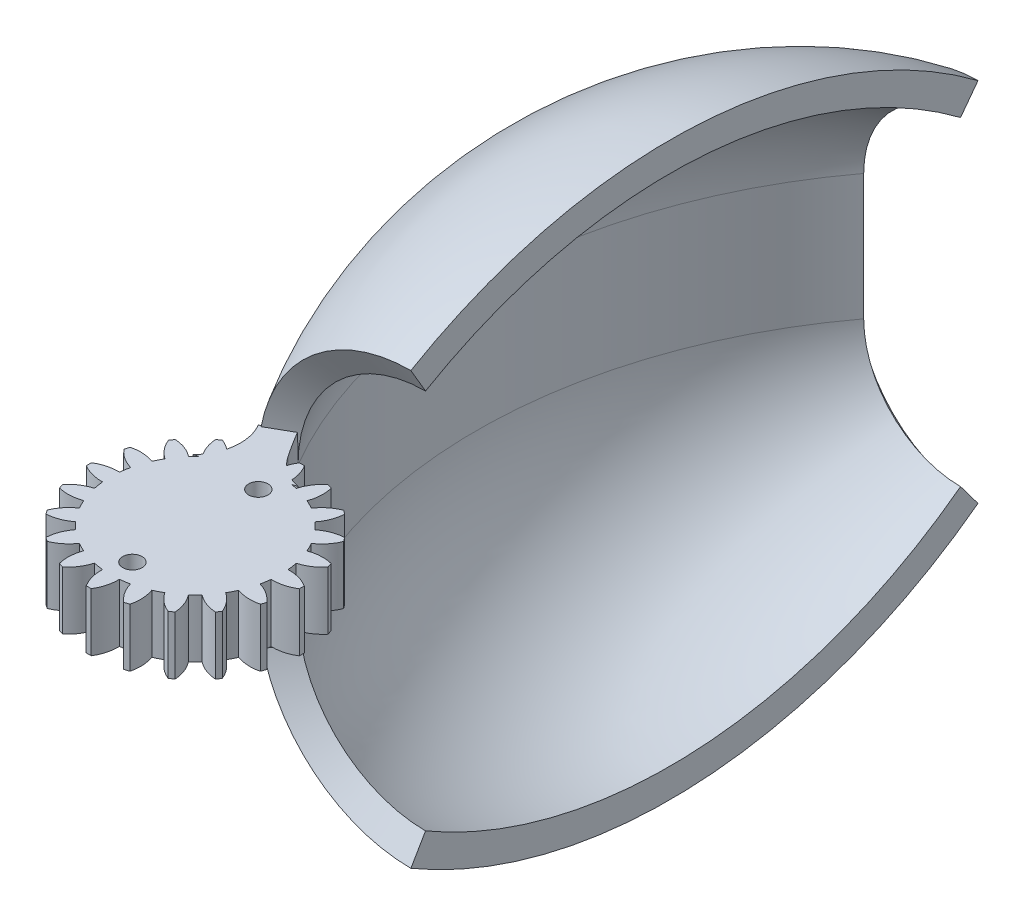
from build123d import *

# Parameters (mm, degrees)
SKETCH_1_R          = 1.25
EXTRUDE_2_DEPTH     = 3
REVOLVE_6_ANGLE     = 90
EXTRUDE_START       = 10
EXTRUDE_3_DEPTH     = 10
REVOLVE_7_ANGLE     = 90
EXTRUDE_4_DEPTH     = 10
CUT_EXTRUDE_START   = -3
CUT_EXTRUDE_1_DEPTH = 3
EXTRUDE_6_DEPTH     = 3
EXTRUDE_7_DEPTH     = 3
SKETCH_9_R          = 1
CUT_EXTRUDE_2_DEPTH = 62.302528599


with BuildPart() as part:
    # 草图1 → 凸台-拉伸2 (new body)
    with BuildSketch(Plane(origin=(0, 0, 0), x_dir=(1, 0, 0), z_dir=(0, 1, 0))):
        with BuildLine():
            Line((-2.4, 31.8), (0, 30))
            ThreePointArc((0, 30), (-9.986161593, 1.176286204), (-1.366875999, -28.085255385))
            ThreePointArc((-1.366875999, -28.085255385), (0.001505949, -29.44044019), (1.780593172, -30.177897759))
            ThreePointArc((1.780593172, -30.177897759), (2.675299798, -47.593181657), (-6.473683781, -32.747686964))
            ThreePointArc((-6.473683781, -32.747686964), (-5.105814689, -29.870106713), (-5.753780394, -26.750543539))
            ThreePointArc((-5.753780394, -26.750543539), (-12.913266641, 3.030876667), (-2.4, 31.8))
        make_face()
        with Locations(Location((0, -39, 0), (0, 0, 270))):
            Circle(SKETCH_1_R, mode=Mode.SUBTRACT)
    extrude(amount=EXTRUDE_2_DEPTH)

    # 草图2 → 旋转6 (revolve)
    with BuildSketch(Plane(origin=(0, 3, 0), x_dir=(1, 0, 0), z_dir=(0, 1, 0))):
        with BuildLine():
            Line((-5.753780394, -26.750543539), (-3.163943768, -25.236361829))
            ThreePointArc((-3.163943768, -25.236361829), (-9.918176076, 2.85931761), (0, 30))
            Line((0, 30), (-2.4, 31.8))
            ThreePointArc((-2.4, 31.8), (-12.913266641, 3.030876667), (-5.753780394, -26.750543539))
        make_face()
    revolve(axis=Axis((10, 3, -9.741803388), (0, 0, -1)), revolution_arc=REVOLVE_6_ANGLE)

    # 草图3 → 凸台-拉伸3 (add)
    with BuildSketch(Plane.XZ.offset(EXTRUDE_START)):
        with BuildLine():
            Line((0, -30), (-2.4, -31.8))
            ThreePointArc((-2.4, -31.8), (-12.913266641, -3.030876667), (-5.753780394, 26.750543539))
            Line((-5.753780394, 26.750543539), (-3.163943768, 25.236361829))
            ThreePointArc((-3.163943768, 25.236361829), (-9.918176076, -2.85931761), (0, -30))
        make_face()
    extrude(amount=-EXTRUDE_3_DEPTH)

    # 草图4 → 旋转7 (revolve)
    with BuildSketch(Plane.XZ.offset(10)):
        with BuildLine():
            Line((-3.163943768, 25.236361829), (-5.753780394, 26.750543539))
            ThreePointArc((-5.753780394, 26.750543539), (-12.913266641, -3.030876667), (-2.4, -31.8))
            Line((-2.4, -31.8), (0, -30))
            ThreePointArc((0, -30), (-9.918176076, -2.85931761), (-3.163943768, 25.236361829))
        make_face()
    revolve(axis=Axis((10, -10, 0), (0, 0, 1)), revolution_arc=REVOLVE_7_ANGLE)

    # 草图5 → 凸台-拉伸4 (add)
    with BuildSketch(Plane.XZ.offset(EXTRUDE_START)):
        with BuildLine():
            Line((-3.163943768, 25.236361829), (-5.753780394, 26.750543539))
            ThreePointArc((-5.753780394, 26.750543539), (-5.18423252, 28.212309525), (-5.095685056, 29.778612154))
            ThreePointArc((-5.095685056, 29.778612154), (-4.685606345, 30.69066229), (-3.690708402, 30.791548776))
            ThreePointArc((-3.690708402, 30.791548776), (-2.675299798, 30.406818343), (-1.620948336, 30.147174096))
            ThreePointArc((-1.620948336, 30.147174096), (-0.859137451, 29.499374608), (-1.039242822, 28.515727285))
            ThreePointArc((-1.039242822, 28.515727285), (-1.208885496, 28.304925583), (-1.366875999, 28.085255385))
            ThreePointArc((-1.366875999, 28.085255385), (-2.289406726, 26.675945695), (-3.163943768, 25.236361829))
        make_face()
    extrude(amount=-EXTRUDE_4_DEPTH)

    # 草图7 → 切除-拉伸1 (cut)
    with BuildSketch(Plane(origin=(0, 3, 0), x_dir=(1, 0, 0), z_dir=(0, 1, 0)).offset(CUT_EXTRUDE_START)):
        with BuildLine():
            Line((-6.473683781, -32.747686964), (0, -39))
            Line((0, -39), (1.780593172, -30.177897759))
            ThreePointArc((1.780593172, -30.177897759), (2.675299798, -47.593181657), (-6.473683781, -32.747686964))
        make_face()
    extrude(amount=CUT_EXTRUDE_1_DEPTH, mode=Mode.SUBTRACT)

    # 草图8 → 凸台-拉伸6 (add)
    with BuildSketch(Plane(origin=(0, 3, 0), x_dir=(1, 0, 0), z_dir=(0, 1, 0))):
        with BuildLine():
            Line((-6.473683781, -32.747686964), (1.780593172, -30.177897759))
            ThreePointArc((1.780593172, -30.177897759), (0.001505949, -29.44044019), (-1.366875999, -28.085255385))
            ThreePointArc((-1.366875999, -28.085255385), (-2.289406726, -26.675945695), (-3.163943768, -25.236361829))
            Line((-3.163943768, -25.236361829), (-5.753780394, -26.750543539))
            ThreePointArc((-5.753780394, -26.750543539), (-5.105814689, -29.870106713), (-6.473683781, -32.747686964))
        make_face()
    extrude(amount=EXTRUDE_6_DEPTH)

    # 草图6 → 凸台-拉伸7 (add, symmetric)
    with BuildSketch(Plane(origin=(0, 3, 0), x_dir=(1, 0, 0), z_dir=(0, 1, 0))):
        with BuildLine():
            ThreePointArc((0.248482904, -49.997193108), (0.730347264, -48.898415235), (0.864685889, -47.706165592))
            ThreePointArc((0.864685889, -47.706165592), (1.360749528, -47.642532136), (1.852366606, -47.550657224))
            ThreePointArc((1.852366606, -47.550657224), (2.34655871, -48.643945951), (3.142741235, -49.541497879))
            ThreePointArc((3.142741235, -49.541497879), (3.38962735, -49.464722951), (3.634640845, -49.382166726))
            ThreePointArc((3.634640845, -49.382166726), (3.75338005, -48.188262593), (3.512718273, -47.012852884))
            ThreePointArc((3.512718273, -47.012852884), (3.96483901, -46.799041776), (4.404003727, -46.55974551))
            ThreePointArc((4.404003727, -46.55974551), (5.211853144, -47.44681112), (6.246426521, -48.054399799))
            ThreePointArc((6.246426521, -48.054399799), (6.457504412, -47.905090498), (6.665014817, -47.750861528))
            ThreePointArc((6.665014817, -47.750861528), (6.409005844, -46.578698791), (5.816901318, -45.535186307))
            ThreePointArc((5.816901318, -45.535186307), (6.180822425, -45.192126868), (6.524546278, -44.828833234))
            ThreePointArc((6.524546278, -44.828833234), (7.566975078, -45.422843564), (8.738668058, -45.680993981))
            ThreePointArc((8.738668058, -45.680993981), (8.89327595, -45.473765742), (9.042970701, -45.262961033))
            ThreePointArc((9.042970701, -45.262961033), (8.437273493, -44.227279147), (7.551685533, -43.41781016))
            ThreePointArc((7.551685533, -43.41781016), (7.791783877, -42.979083439), (8.00642078, -42.527354149))
            ThreePointArc((8.00642078, -42.527354149), (9.18138877, -42.770163329), (10.37550788, -42.653605923))
            ThreePointArc((10.37550788, -42.653605923), (10.458511675, -42.408743689), (10.535737606, -42.161998276))
            ThreePointArc((10.535737606, -42.161998276), (9.639642026, -41.364177), (8.547258152, -40.867987975))
            ThreePointArc((8.547258152, -40.867987975), (8.640031234, -40.376539599), (8.704571032, -39.880593064))
            ThreePointArc((8.704571032, -39.880593064), (9.897064159, -39.74843324), (10.9967207, -39.268577461))
            ThreePointArc((10.9967207, -39.268577461), (10.999995409, -39.010050055), (10.997193108, -38.751517096))
            ThreePointArc((10.997193108, -38.751517096), (9.898415235, -38.269652736), (8.706165592, -38.135314111))
            ThreePointArc((8.706165592, -38.135314111), (8.642532136, -37.639250472), (8.550657224, -37.147633394))
            ThreePointArc((8.550657224, -37.147633394), (9.643945951, -36.65344129), (10.541497879, -35.857258765))
            ThreePointArc((10.541497879, -35.857258765), (10.464722951, -35.61037265), (10.382166726, -35.365359155))
            ThreePointArc((10.382166726, -35.365359155), (9.188262593, -35.24661995), (8.012852884, -35.487281727))
            ThreePointArc((8.012852884, -35.487281727), (7.799041776, -35.03516099), (7.55974551, -34.595996273))
            ThreePointArc((7.55974551, -34.595996273), (8.44681112, -33.788146856), (9.054399799, -32.753573479))
            ThreePointArc((9.054399799, -32.753573479), (8.905090498, -32.542495588), (8.750861528, -32.334985183))
            ThreePointArc((8.750861528, -32.334985183), (7.578698791, -32.590994156), (6.535186307, -33.183098682))
            ThreePointArc((6.535186307, -33.183098682), (6.192126868, -32.819177575), (5.828833234, -32.475453722))
            ThreePointArc((5.828833234, -32.475453722), (6.422843564, -31.433024922), (6.680993981, -30.261331942))
            ThreePointArc((6.680993981, -30.261331942), (6.473765742, -30.10672405), (6.262961033, -29.957029299))
            ThreePointArc((6.262961033, -29.957029299), (5.227279147, -30.562726507), (4.41781016, -31.448314467))
            ThreePointArc((4.41781016, -31.448314467), (3.979083439, -31.208216123), (3.527354149, -30.99357922))
            ThreePointArc((3.527354149, -30.99357922), (3.770163329, -29.81861123), (3.653605923, -28.62449212))
            ThreePointArc((3.653605923, -28.62449212), (3.408743689, -28.541488325), (3.161998276, -28.464262394))
            ThreePointArc((3.161998276, -28.464262394), (2.364177, -29.360357974), (1.867987975, -30.452741848))
            ThreePointArc((1.867987975, -30.452741848), (1.376539599, -30.359968766), (0.880593064, -30.295428968))
            ThreePointArc((0.880593064, -30.295428968), (0.74843324, -29.102935841), (0.268577461, -28.0032793))
            ThreePointArc((0.268577461, -28.0032793), (0.010050055, -28.000004591), (-0.248482904, -28.002806892))
            ThreePointArc((-0.248482904, -28.002806892), (-0.730347264, -29.101584765), (-0.864685889, -30.293834408))
            ThreePointArc((-0.864685889, -30.293834408), (-1.360749528, -30.357467864), (-1.852366606, -30.449342776))
            ThreePointArc((-1.852366606, -30.449342776), (-2.34655871, -29.356054049), (-3.142741235, -28.458502121))
            ThreePointArc((-3.142741235, -28.458502121), (-3.38962735, -28.535277049), (-3.634640845, -28.617833274))
            ThreePointArc((-3.634640845, -28.617833274), (-3.75338005, -29.811737407), (-3.512718273, -30.987147116))
            ThreePointArc((-3.512718273, -30.987147116), (-3.96483901, -31.200958224), (-4.404003727, -31.44025449))
            ThreePointArc((-4.404003727, -31.44025449), (-5.211853144, -30.55318888), (-6.246426521, -29.945600201))
            ThreePointArc((-6.246426521, -29.945600201), (-6.457504412, -30.094909502), (-6.665014817, -30.249138472))
            ThreePointArc((-6.665014817, -30.249138472), (-6.409005844, -31.421301209), (-5.816901318, -32.464813693))
            ThreePointArc((-5.816901318, -32.464813693), (-6.180822425, -32.807873132), (-6.524546278, -33.171166766))
            ThreePointArc((-6.524546278, -33.171166766), (-7.566975078, -32.577156436), (-8.738668058, -32.319006019))
            ThreePointArc((-8.738668058, -32.319006019), (-8.89327595, -32.526234258), (-9.042970701, -32.737038967))
            ThreePointArc((-9.042970701, -32.737038967), (-8.437273493, -33.772720853), (-7.551685533, -34.58218984))
            ThreePointArc((-7.551685533, -34.58218984), (-7.791783877, -35.020916561), (-8.00642078, -35.472645851))
            ThreePointArc((-8.00642078, -35.472645851), (-9.18138877, -35.229836671), (-10.37550788, -35.346394077))
            ThreePointArc((-10.37550788, -35.346394077), (-10.458511675, -35.591256311), (-10.535737606, -35.838001724))
            ThreePointArc((-10.535737606, -35.838001724), (-9.639642026, -36.635823), (-8.547258152, -37.132012025))
            ThreePointArc((-8.547258152, -37.132012025), (-8.640031234, -37.623460401), (-8.704571032, -38.119406936))
            ThreePointArc((-8.704571032, -38.119406936), (-9.897064159, -38.25156676), (-10.9967207, -38.731422539))
            ThreePointArc((-10.9967207, -38.731422539), (-10.999995409, -38.989949945), (-10.997193108, -39.248482904))
            ThreePointArc((-10.997193108, -39.248482904), (-9.898415235, -39.730347264), (-8.706165592, -39.864685889))
            ThreePointArc((-8.706165592, -39.864685889), (-8.642532136, -40.360749528), (-8.550657224, -40.852366606))
            ThreePointArc((-8.550657224, -40.852366606), (-9.643945951, -41.34655871), (-10.541497879, -42.142741235))
            ThreePointArc((-10.541497879, -42.142741235), (-10.464722951, -42.38962735), (-10.382166726, -42.634640845))
            ThreePointArc((-10.382166726, -42.634640845), (-9.188262593, -42.75338005), (-8.012852884, -42.512718273))
            ThreePointArc((-8.012852884, -42.512718273), (-7.799041776, -42.96483901), (-7.55974551, -43.404003727))
            ThreePointArc((-7.55974551, -43.404003727), (-8.44681112, -44.211853144), (-9.054399799, -45.246426521))
            ThreePointArc((-9.054399799, -45.246426521), (-8.905090498, -45.457504412), (-8.750861528, -45.665014817))
            ThreePointArc((-8.750861528, -45.665014817), (-7.578698791, -45.409005844), (-6.535186307, -44.816901318))
            ThreePointArc((-6.535186307, -44.816901318), (-6.192126868, -45.180822425), (-5.828833234, -45.524546278))
            ThreePointArc((-5.828833234, -45.524546278), (-6.422843564, -46.566975078), (-6.680993981, -47.738668058))
            ThreePointArc((-6.680993981, -47.738668058), (-6.473765742, -47.89327595), (-6.262961033, -48.042970701))
            ThreePointArc((-6.262961033, -48.042970701), (-5.227279147, -47.437273493), (-4.41781016, -46.551685533))
            ThreePointArc((-4.41781016, -46.551685533), (-3.979083439, -46.791783877), (-3.527354149, -47.00642078))
            ThreePointArc((-3.527354149, -47.00642078), (-3.770163329, -48.18138877), (-3.653605923, -49.37550788))
            ThreePointArc((-3.653605923, -49.37550788), (-3.408743689, -49.458511675), (-3.161998276, -49.535737606))
            ThreePointArc((-3.161998276, -49.535737606), (-2.364177, -48.639642026), (-1.867987975, -47.547258152))
            ThreePointArc((-1.867987975, -47.547258152), (-1.376539599, -47.640031234), (-0.880593064, -47.704571032))
            ThreePointArc((-0.880593064, -47.704571032), (-0.74843324, -48.897064159), (-0.268577461, -49.9967207))
            ThreePointArc((-0.268577461, -49.9967207), (-0.010050055, -49.999995409), (0.248482904, -49.997193108))
        make_face()
    extrude(amount=EXTRUDE_7_DEPTH, both=True)

    # 草图9 → 切除-拉伸2 (cut, through all)
    with BuildSketch(Plane.XZ):
        with Locations(Location((0, 45.5, 0), (0, 0, 270))):
            Circle(SKETCH_9_R)
        with Locations(Location((0, 32.5, 0), (0, 0, 270))):
            Circle(SKETCH_9_R)
    extrude(amount=-CUT_EXTRUDE_2_DEPTH, mode=Mode.SUBTRACT)


solid = part.part
